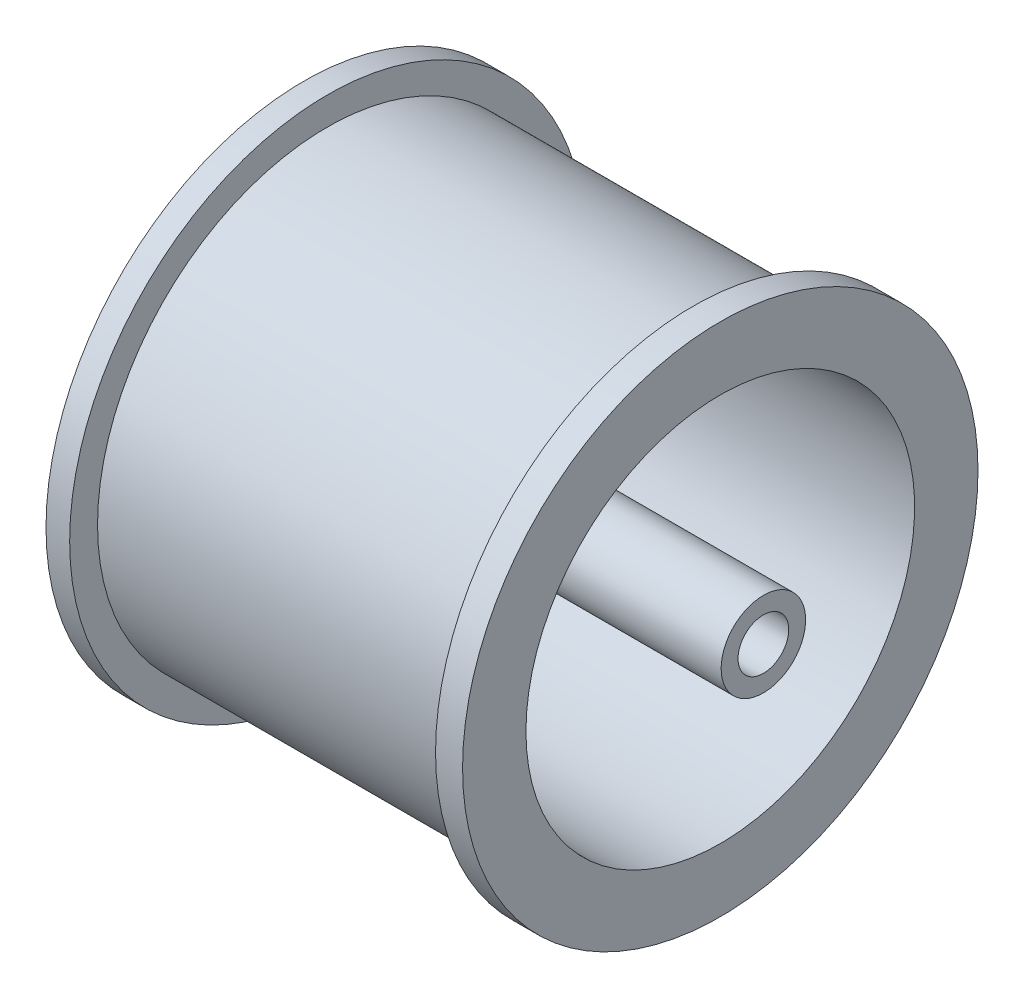
from build123d import *

# Parameters (mm, degrees)
SKETCH4_R           = 1.5
CUT_EXTRUDE1_DEPTH  = 15
CUT_EXTRUDE3_DEPTH  = 15
FILLET1_R           = 2
SKETCH8_R           = 1.305513627
BOSS_EXTRUDE1_DEPTH = 1


with BuildPart() as part:
    # Sketch1 → Revolve1 (revolve)
    with BuildSketch(Plane.XY, mode=Mode.PRIVATE) as revolve1_sk:
        Polygon((0, 15.25), (0, 11.5), (3.6, 11.5), (3.6, 10), (6.6, 10), (6.6, 11.5), (24.65, 11.5), (24.65, 15.25), (23.05, 15.25), (23.05, 13.6), (1.4, 13.6), (1.4, 15.25), align=None)
    revolve(revolve1_sk.sketch.rotate(Axis((0, 0, 0), (1, 0, 0)), 90), axis=Axis((0, 0, 0), (1, 0, 0)))



with BuildPart() as body_2:
    # Sketch3 → Revolve2 (revolve)
    with BuildSketch(Plane.XY, mode=Mode.PRIVATE) as revolve2_sk:
        Polygon((1.5, 0), (27.2, 0), (27.2, 2.5), (5.171947712, 2.5), (1.5, 4.62), align=None)
    revolve(revolve2_sk.sketch.rotate(Axis((0, 0, 0), (1, 0, 0)), 90), axis=Axis((0, 0, 0), (1, 0, 0)))

    # Sketch4 → Cut-Extrude1 (cut)
    with BuildSketch(Plane(origin=(27.2, 0, 0), x_dir=(0, 0, -1), z_dir=(1, 0, 0))):
        Circle(SKETCH4_R)
    extrude(amount=-CUT_EXTRUDE1_DEPTH, mode=Mode.SUBTRACT)


with BuildPart() as part_1:
    add(part.part)

    add(body_2.part)  # Revolve4 merges body 2
    # Sketch5 → Revolve4 (revolve)
    with BuildSketch(Plane.XY):
        Polygon((0, 0), (0, 10), (3.6, 11.5), (3.6, 9.258144762), (1.5, 8.383144762), (1.5, 0), align=None)
    revolve(axis=Axis((1.5, 0, 0), (-1, 0, 0)))

    # Sketch6 → Cut-Extrude3 (cut)
    with BuildSketch(Plane.ZY):
        with BuildLine():
            Line((2.75, 5), (-2.75, 5))
            Line((-2.75, 5), (-5.536071385, 8.320310583))
            ThreePointArc((-5.536071385, 8.320310583), (0, 9.993780795), (5.536071385, 8.320310583))
            Line((5.536071385, 8.320310583), (2.75, 5))
        make_face()
        with BuildLine():
            Line((5, 2.75), (8.320310583, 5.536071385))
            ThreePointArc((8.320310583, 5.536071385), (9.993780795, 0), (8.320310583, -5.536071385))
            Line((8.320310583, -5.536071385), (5, -2.75))
            Line((5, -2.75), (5, 2.75))
        make_face()
        with BuildLine():
            Line((2.75, -5), (5.536071385, -8.320310583))
            ThreePointArc((5.536071385, -8.320310583), (0, -9.993780795), (-5.536071385, -8.320310583))
            Line((-5.536071385, -8.320310583), (-2.75, -5))
            Line((-2.75, -5), (2.75, -5))
        make_face()
        with BuildLine():
            Line((-5, -2.75), (-8.320310583, -5.536071385))
            ThreePointArc((-8.320310583, -5.536071385), (-9.993780795, 0), (-8.320310583, 5.536071385))
            Line((-8.320310583, 5.536071385), (-5, 2.75))
            Line((-5, 2.75), (-5, -2.75))
        make_face()
    extrude(amount=-CUT_EXTRUDE3_DEPTH, mode=Mode.SUBTRACT)

    # Sketch7 → Cut-Revolve1 (revolve, cut)
    with BuildSketch(Plane.XY):
        Polygon((3.1, 0), (0, 0), (0, 4.25), (3.1, 2.460214166), align=None)
    revolve(axis=Axis((3.1, 0, 0), (-1, 0, 0)), mode=Mode.SUBTRACT)

    # Fillet1
    fillet1_edges = [part_1.edges().sort_by_distance(p)[0] for p in [
        (3.1, -2.460214166, 0),
    ]]
    fillet(fillet1_edges, radius=FILLET1_R)

    # Sketch8 → Boss-Extrude1 (add)
    with BuildSketch(Plane.ZY.offset(-3.1)):
        with Locations(Location((0, 0, 0), (0, 0, 270))):
            Circle(SKETCH8_R)
    extrude(amount=BOSS_EXTRUDE1_DEPTH)


solid = part_1.part
